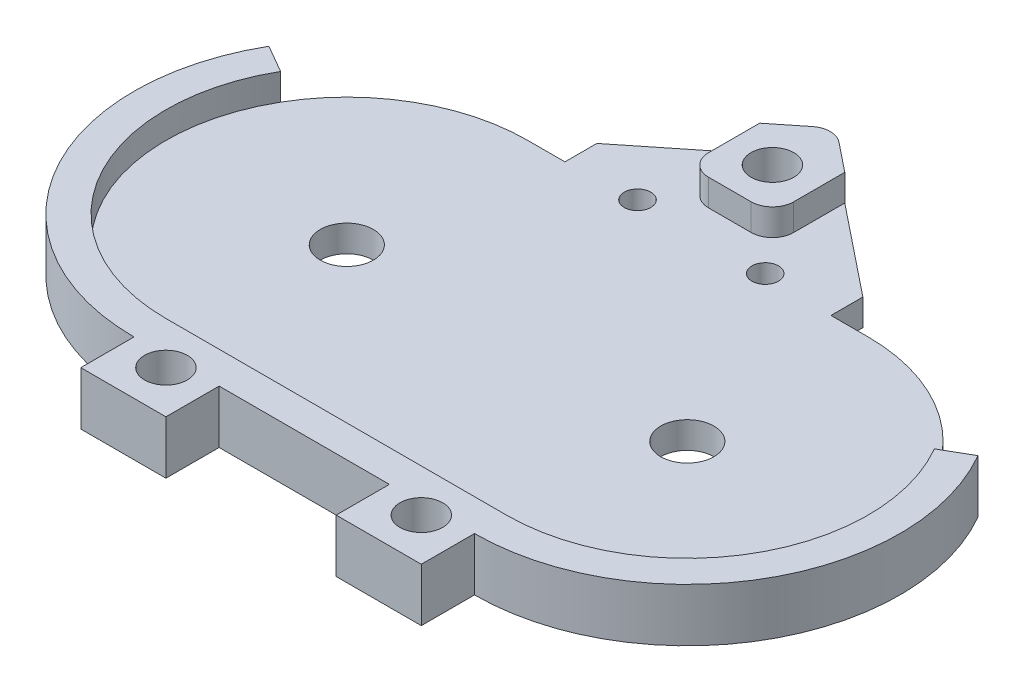
from build123d import *

# Parameters (mm, degrees)
SKETCH1_R                    = 3.175
SKETCH1_R_2                  = 1.5875
BOSS_EXTRUDE1_DEPTH          = 3.175
CUT_EXTRUDE1_REACH           = 61.599
BOSS_EXTRUDE2_DEPTH          = 3.175
TAP_DRILL_FOR_10_HELICOIL2_D = 5.1054
FILLET1_R                    = 2.54
CUT_EXTRUDE2_REACH           = 61.146
SKETCH20_W                   = 20.32
SKETCH20_H                   = 6.35


with BuildPart() as part:
    # Sketch1 → Boss-Extrude1 (new body)
    with BuildSketch(Plane(origin=(0, 0, 0), x_dir=(1, 0, 0), z_dir=(0, 1, 0))):
        with BuildLine():
            Line((-20.32, 25.4), (-15.875, 25.4))
            Line((-15.875, 25.4), (0, 38.1))
            Line((0, 38.1), (15.875, 25.4))
            Line((15.875, 25.4), (20.32, 25.4))
            ThreePointArc((20.32, 25.4), (45.72, 0), (20.32, -25.4))
            Line((20.32, -25.4), (20.32, -31.75))
            Line((20.32, -31.75), (-20.32, -31.75))
            Line((-20.32, -31.75), (-20.32, -25.4))
            ThreePointArc((-20.32, -25.4), (-45.72, 0), (-20.32, 25.4))
        make_face()
        with Locations(Location((20.32, 0, 0), (0, 0, 270))):
            Circle(SKETCH1_R, mode=Mode.SUBTRACT)
        with Locations(Location((7.62, 21.997045256, 0), (0, 0, 270))):
            Circle(SKETCH1_R_2, mode=Mode.SUBTRACT)
        with Locations(Location((-20.32, 0, 0), (0, 0, 270))):
            Circle(SKETCH1_R, mode=Mode.SUBTRACT)
        with Locations(Location((-7.62, 21.997045256, 0), (0, 0, 270))):
            Circle(SKETCH1_R_2, mode=Mode.SUBTRACT)
    extrude(amount=BOSS_EXTRUDE1_DEPTH)

    # Sketch7 → Cut-Extrude1 (cut, up to next)
    with BuildSketch(Plane(origin=(0, 3.175, 0), x_dir=(1, 0, 0), z_dir=(0, 1, 0)), mode=Mode.PRIVATE) as cut_extrude1_sk1:
        with BuildLine():
            Line((-42.317045256, 12.7), (-39.017488468, 10.795))
            ThreePointArc((-39.017488468, 10.795), (-31.115, 18.697488468), (-20.32, 21.59))
            Line((-20.32, 21.59), (-15.875, 21.59))
            Line((-15.875, 21.59), (-15.875, 25.008038208))
            ThreePointArc((-15.875, 25.008038208), (-18.088875897, 25.301819801), (-20.32, 25.4))
            ThreePointArc((-20.32, 25.4), (-33.02, 21.997045256), (-42.317045256, 12.7))
        make_face()
    cut_extrude1_tool1 = extrude(cut_extrude1_sk1.sketch, amount=-CUT_EXTRUDE1_REACH, mode=Mode.PRIVATE) & part.part
    # Sketch7 → Cut-Extrude1 (cut, up to next)
    with BuildSketch(Plane(origin=(0, 3.175, 0), x_dir=(1, 0, 0), z_dir=(0, 1, 0)), mode=Mode.PRIVATE) as cut_extrude1_sk2:
        with BuildLine():
            Line((-15.875, 25.4), (-20.32, 25.4))
            ThreePointArc((-20.32, 25.4), (-18.088875897, 25.301819801), (-15.875, 25.008038208))
            Line((-15.875, 25.008038208), (-15.875, 25.4))
        make_face()
    cut_extrude1_tool2 = extrude(cut_extrude1_sk2.sketch, amount=-CUT_EXTRUDE1_REACH, mode=Mode.PRIVATE) & part.part
    cut_extrude1_1 = cut_extrude1_tool1.solids().sort_by_distance((-29.568041, 3.175, -20.060943))[0]
    add(cut_extrude1_1, mode=Mode.SUBTRACT)
    cut_extrude1_2 = cut_extrude1_tool2.solids().sort_by_distance((-16.984528, 3.175, -25.282569))[0]
    add(cut_extrude1_2, mode=Mode.SUBTRACT)
    cut_extrude1 = cut_extrude1_1 + cut_extrude1_2  # Cut-Extrude1 as one shape, for the pattern or mirror that repeats it

    # Sketch9 → Boss-Extrude2 (add)
    with BuildSketch(Plane(origin=(0, 3.175, 0), x_dir=(1, 0, 0), z_dir=(0, 1, 0))):
        with BuildLine():
            Line((-39.017488468, 10.795), (-42.317045256, 12.7))
            ThreePointArc((-42.317045256, 12.7), (-42.317045256, -12.7), (-20.32, -25.4))
            Line((-20.32, -25.4), (-20.32, -31.75))
            Line((-20.32, -31.75), (-10.16, -31.75))
            Line((-10.16, -31.75), (-10.16, -25.4))
            Line((-10.16, -25.4), (0, -25.4))
            Line((0, -25.4), (0, -21.59))
            Line((0, -21.59), (-20.32, -21.59))
            ThreePointArc((-20.32, -21.59), (-39.017488468, -10.795), (-39.017488468, 10.795))
        make_face()
        Polygon((0, 38.1), (-5.08, 34.036), (-5.08, 25.4), (0, 25.4), align=None)
    boss_extrude2 = extrude(amount=BOSS_EXTRUDE2_DEPTH)

    # Mirror1: Cut-Extrude1, Boss-Extrude2 across plane
    add(cut_extrude1.mirror(Plane(origin=(0, 0, 0), x_dir=(0, 0, 1), z_dir=(1, 0, 0))), mode=Mode.SUBTRACT)
    add(boss_extrude2.mirror(Plane(origin=(0, 0, 0), x_dir=(0, 0, 1), z_dir=(1, 0, 0))))

    # Tap Drill for #10 Helicoil2 (through all)
    with Locations(Plane(origin=(0, 6.35, 0), x_dir=(1, 0, 0), z_dir=(0, 1, 0))):
        with Locations((-15.24, -26.67), (15.24, -26.67), (0, 30.48)):
            Hole(TAP_DRILL_FOR_10_HELICOIL2_D / 2)

    # Fillet1
    fillet1_edges = [part.edges().sort_by_distance(p)[0] for p in [
        (5.08, 4.7625, -25.4),
        (0, 3.175, -38.1),
        (-5.08, 4.7625, -25.4),
    ]]
    fillet(fillet1_edges, radius=FILLET1_R)

    # Sketch20 → Cut-Extrude2 (cut, up to next)
    with BuildSketch(Plane(origin=(0, 3.175, 0), x_dir=(1, 0, 0), z_dir=(0, 1, 0)), mode=Mode.PRIVATE) as cut_extrude2_sk1:
        with Locations((0, -28.575)):
            Rectangle(SKETCH20_W, SKETCH20_H)
    cut_extrude2_tool1 = extrude(cut_extrude2_sk1.sketch, amount=-CUT_EXTRUDE2_REACH, mode=Mode.PRIVATE) & part.part
    add(cut_extrude2_tool1.solids().sort_by_distance((0, 3.175, 28.575))[0], mode=Mode.SUBTRACT)


solid = part.part
